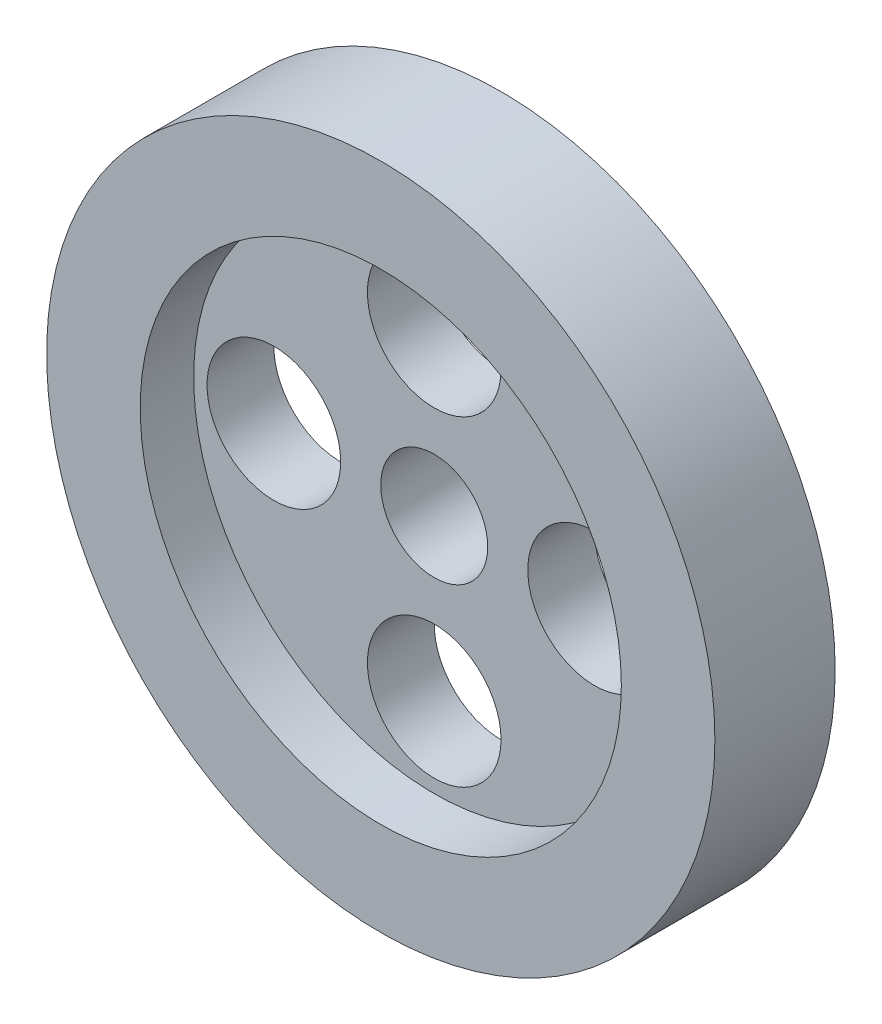
from build123d import *
from build123d.topology import SkipClean

# Parameters (mm, degrees)
SKETCH1_R           = 25
SKETCH1_R_2         = 5
SKETCH1_R_3         = 4
BOSS_EXTRUDE1_DEPTH = 9
SKETCH2_R           = 18
CUT_EXTRUDE1_DEPTH  = 4
BOSS_EXTRUDE5_START = 1
SKETCH3_R           = 6
SKETCH3_R_2         = 4
BOSS_EXTRUDE5_DEPTH = 1


with BuildPart() as part:
    # Sketch1 → Boss-Extrude1 (new body)
    with BuildSketch(Plane.XY):
        Circle(SKETCH1_R)
        with Locations((0, 12)):
            Circle(SKETCH1_R_2, mode=Mode.SUBTRACT)
        with Locations((12, 0)):
            Circle(SKETCH1_R_2, mode=Mode.SUBTRACT)
        with Locations((0, -12)):
            Circle(SKETCH1_R_2, mode=Mode.SUBTRACT)
        with Locations((-12, 0)):
            Circle(SKETCH1_R_2, mode=Mode.SUBTRACT)
        Circle(SKETCH1_R_3, mode=Mode.SUBTRACT)
    extrude(amount=BOSS_EXTRUDE1_DEPTH)

    # Sketch2 → Cut-Extrude1 (cut)
    with BuildSketch(Plane.XY.offset(9)):
        Circle(SKETCH2_R)
    extrude(amount=-CUT_EXTRUDE1_DEPTH, mode=Mode.SUBTRACT)

    # Sketch3 → Boss-Extrude5 (add)
    with SkipClean():  # the faces are left unmerged after this step: merging them gives an invalid solid
        with BuildSketch(Plane(origin=(0, 0, 0), x_dir=(-1, 0, 0), z_dir=(0, 0, -1)).offset(BOSS_EXTRUDE5_START)):
            with Locations(Location((0, 0, 0), (0, 0, 180))):
                Circle(SKETCH3_R)
            Circle(SKETCH3_R_2, mode=Mode.SUBTRACT)
        extrude(amount=-BOSS_EXTRUDE5_DEPTH)


solid = part.part
